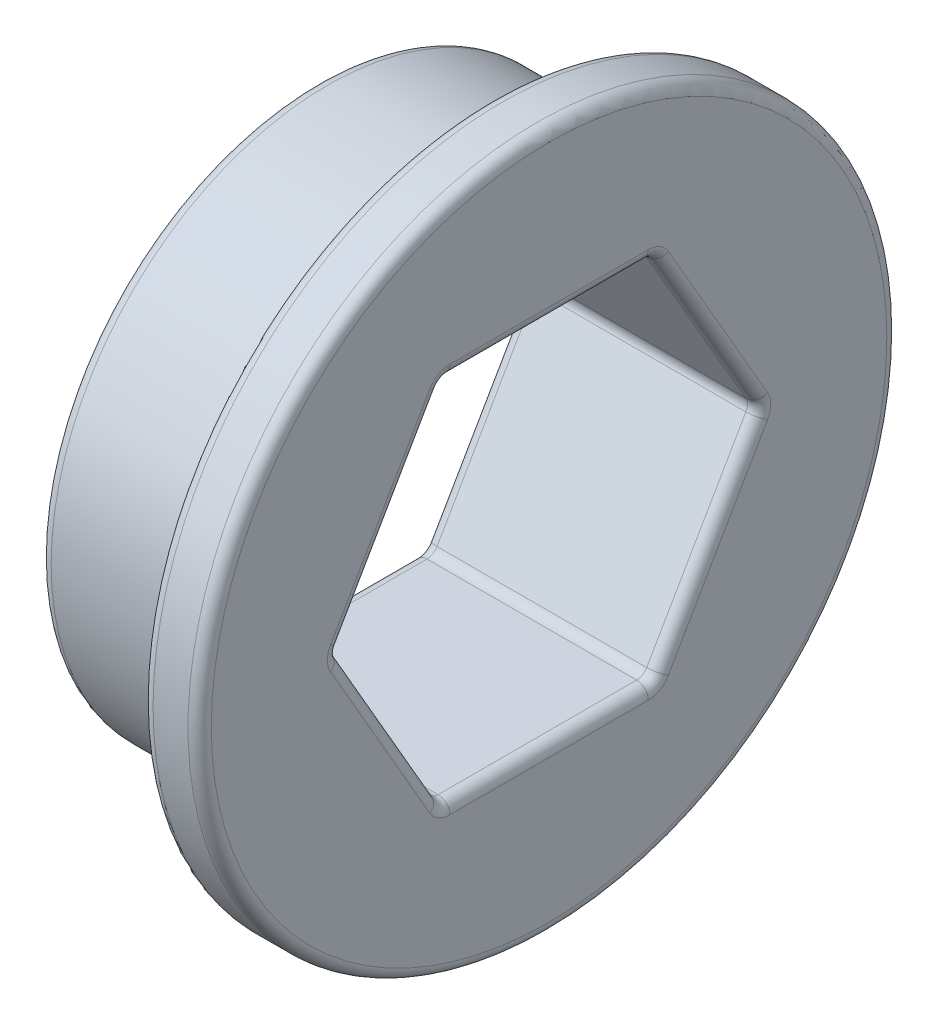
from build123d import *

# Parameters (mm, degrees)
CUT_EXTRUDE1_REACH = 11.381
FILLET1_R          = 0.2


with BuildPart() as part:
    # Sketch1 → Revolve1 (revolve)
    with BuildSketch(Plane.XY, mode=Mode.PRIVATE) as revolve1_sk:
        Polygon((-4, 0), (-4, 4.75), (-1, 4.75), (-1, 6), (0, 6), (0, 0), align=None)
    revolve(revolve1_sk.sketch.rotate(Axis((0, 0, 0), (-1, 0, 0)), 90), axis=Axis((0, 0, 0), (-1, 0, 0)))

    # Sketch2 → Cut-Extrude1 (cut, up to next)
    with BuildSketch(Plane(origin=(0, 0, 0), x_dir=(0, 0, -1), z_dir=(1, 0, 0)), mode=Mode.PRIVATE) as cut_extrude1_sk1:
        Polygon((3.637306696, 0), (1.818653348, 3.15), (-1.818653348, 3.15), (-3.637306696, 0), (-1.818653348, -3.15), (1.818653348, -3.15), align=None)
    cut_extrude1_tool1 = extrude(cut_extrude1_sk1.sketch, amount=-CUT_EXTRUDE1_REACH, mode=Mode.PRIVATE) & part.part
    add(cut_extrude1_tool1.solids().sort_by_distance((0, 0, 0))[0], mode=Mode.SUBTRACT)

    # Fillet1
    fillet1_edges = [part.edges().sort_by_distance(p)[0] for p in [
        (-4, -1.575, -2.727980022),
        (-2, 0, -3.637306696),
        (-4, -3.15, 0),
        (-2, -3.15, -1.818653348),
        (-4, -1.575, 2.727980022),
        (-2, -3.15, 1.818653348),
        (-4, 1.575, 2.727980022),
        (-2, 0, 3.637306696),
        (-4, 3.15, 0),
        (-2, 3.15, 1.818653348),
        (-4, 1.575, -2.727980022),
        (-2, 3.15, -1.818653348),
        (0, -1.575, -2.727980022),
        (0, 1.575, -2.727980022),
        (0, 3.15, 0),
        (0, 1.575, 2.727980022),
        (0, -1.575, 2.727980022),
        (0, -3.15, 0),
        (0, 0, 6),
        (-1, 0, 6),
        (-1, 0, 4.75),
        (-4, 0, 4.75),
    ]]
    fillet(fillet1_edges, radius=FILLET1_R)


solid = part.part
